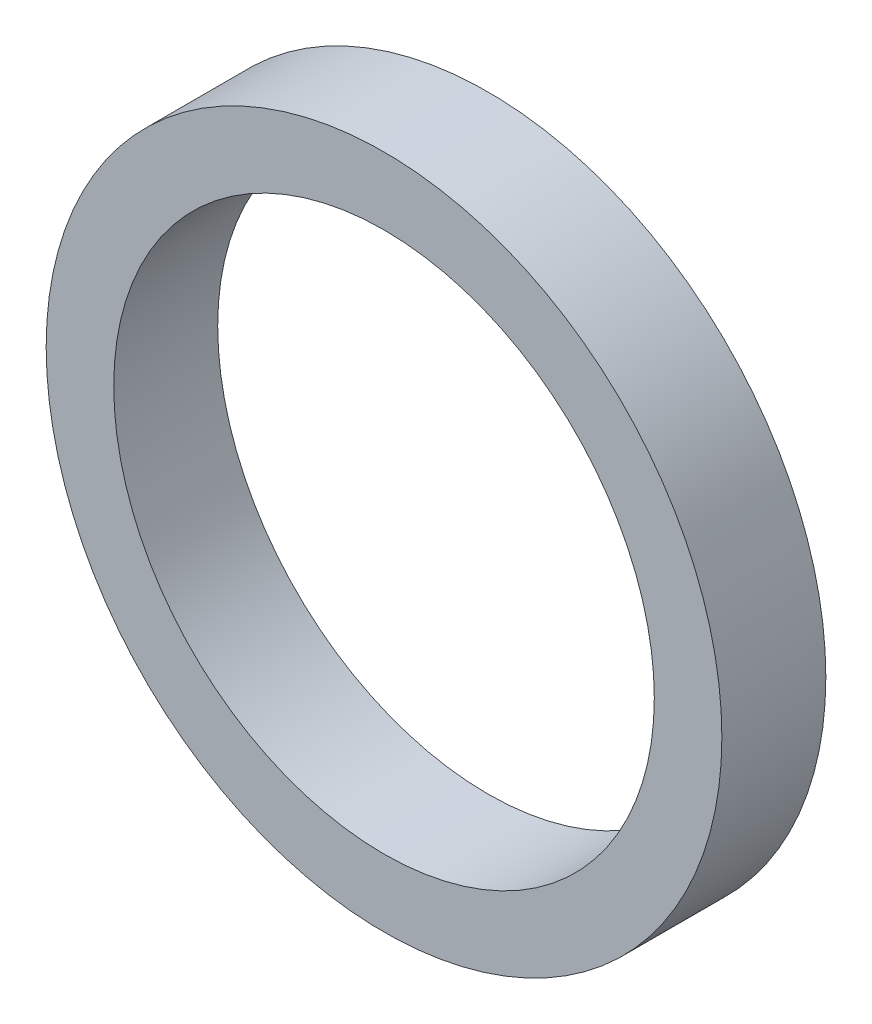
from build123d import *

# Parameters (mm, degrees)
SKETCH1_R           = 3.25
SKETCH1_R_2         = 2.6
BOSS_EXTRUDE1_DEPTH = 1


with BuildPart() as part:
    # Sketch1 → Boss-Extrude1 (new body)
    with BuildSketch(Plane.XY.offset(3)):
        with Locations((33, 0)):
            Circle(SKETCH1_R)
        with Locations((33, 0)):
            Circle(SKETCH1_R_2, mode=Mode.SUBTRACT)
    extrude(amount=BOSS_EXTRUDE1_DEPTH)


solid = part.part
